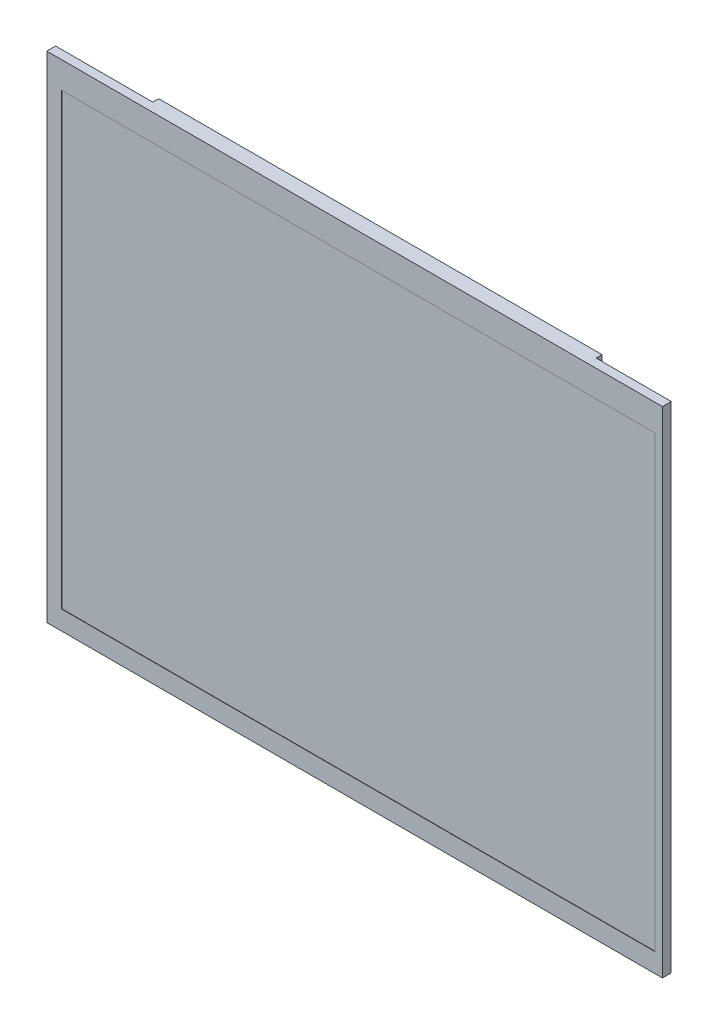
from build123d import *

# Parameters (mm, degrees)
SKETCH_1_W        = 209
SKETCH_1_H        = 168
SKETCH_1_W_2      = 201.5
SKETCH_1_H_2      = 152.5
EXTRUDE_1_1_DEPTH = 3
SKETCH_1_3_W      = 201.5
SKETCH_1_3_H      = 152.5
EXTRUDE_1_2_DEPTH = 2.9
SKETCH_3_W        = 150.5
SKETCH_3_H        = 9
EXTRUDE_2_1_DEPTH = 2


with BuildPart() as part:
    # 草图1 → 1-1 (new body)
    with BuildSketch(Plane.XY):
        with Locations((104.5, 84)):
            Rectangle(SKETCH_1_W, SKETCH_1_H)
        with Locations((105.75, 82.75)):
            Rectangle(SKETCH_1_W_2, SKETCH_1_H_2, mode=Mode.SUBTRACT)
    extrude(amount=EXTRUDE_1_1_DEPTH)

    # 草图1<3> → 1-2 (add)
    with BuildSketch(Plane.XY):
        with Locations((105.75, 82.75)):
            Rectangle(SKETCH_1_3_W, SKETCH_1_3_H)
    extrude(amount=EXTRUDE_1_2_DEPTH)

    # 草图3 → 2-1 (add)
    with BuildSketch(Plane(origin=(0, 0, 0), x_dir=(-1, 0, 0), z_dir=(0, 0, -1))):
        with Locations((-108.25, 163.5)):
            Rectangle(SKETCH_3_W, SKETCH_3_H)
    extrude(amount=EXTRUDE_2_1_DEPTH)


solid = part.part
